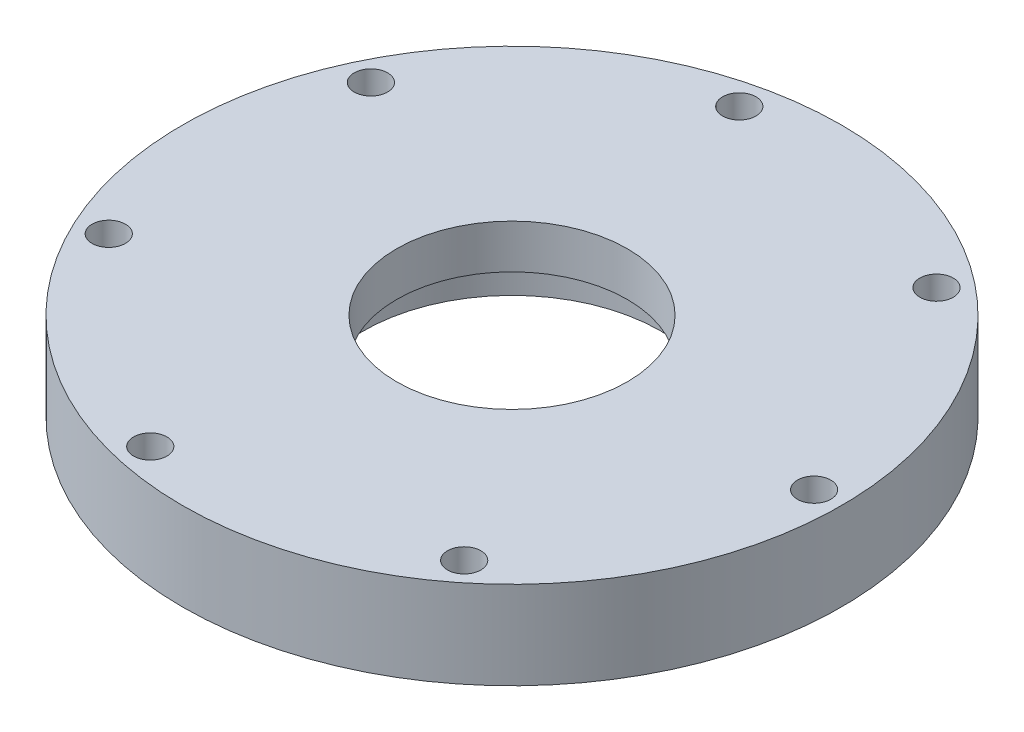
from build123d import *

# Parameters (mm, degrees)
CROQUIS1_R              = 30
CROQUIS1_R_2            = 10.5
SALIENTE_EXTRUIR1_DEPTH = 8
CROQUIS2_R              = 13.53
CORTAR_EXTRUIR1_DEPTH   = 4
CROQUIS3_R              = 1.52
CORTAR_EXTRUIR2_DEPTH   = 44.17406629


with BuildPart() as part:
    # Croquis1 → Saliente-Extruir1 (new body)
    with BuildSketch(Plane(origin=(0, 0, 0), x_dir=(1, 0, 0), z_dir=(0, 1, 0))):
        with Locations(Location((0, 0, 0), (0, 0, 270))):
            Circle(CROQUIS1_R)
        with Locations(Location((0, 0, 0), (0, 0, 270))):
            Circle(CROQUIS1_R_2, mode=Mode.SUBTRACT)
    extrude(amount=SALIENTE_EXTRUIR1_DEPTH)

    # Croquis2 → Cortar-Extruir1 (cut)
    with BuildSketch(Plane.XZ):
        with Locations(Location((0, 0, 0), (0, 0, 270))):
            Circle(CROQUIS2_R)
    extrude(amount=-CORTAR_EXTRUIR1_DEPTH, mode=Mode.SUBTRACT)

    # Croquis3 → Cortar-Extruir2 (cut, through all)
    with BuildSketch(Plane(origin=(0, 8, 0), x_dir=(1, 0, 0), z_dir=(0, 1, 0))):
        with Locations(Location((27.5, 0, 0), (0, 0, 270))):
            Circle(CROQUIS3_R)
        with Locations(Location((17.145969551, -21.500365768, 0), (0, 0, 270))):
            Circle(CROQUIS3_R)
        with Locations(Location((-6.119325684, -26.810517585, 0), (0, 0, 270))):
            Circle(CROQUIS3_R)
        with Locations(Location((-24.776643867, -11.931802826, 0), (0, 0, 270))):
            Circle(CROQUIS3_R)
        with Locations(Location((-24.776643867, 11.931802826, 0), (0, 0, 270))):
            Circle(CROQUIS3_R)
        with Locations(Location((-6.119325684, 26.810517585, 0), (0, 0, 270))):
            Circle(CROQUIS3_R)
        with Locations(Location((17.145969551, 21.500365768, 0), (0, 0, 270))):
            Circle(CROQUIS3_R)
    extrude(amount=-CORTAR_EXTRUIR2_DEPTH, mode=Mode.SUBTRACT)


solid = part.part
